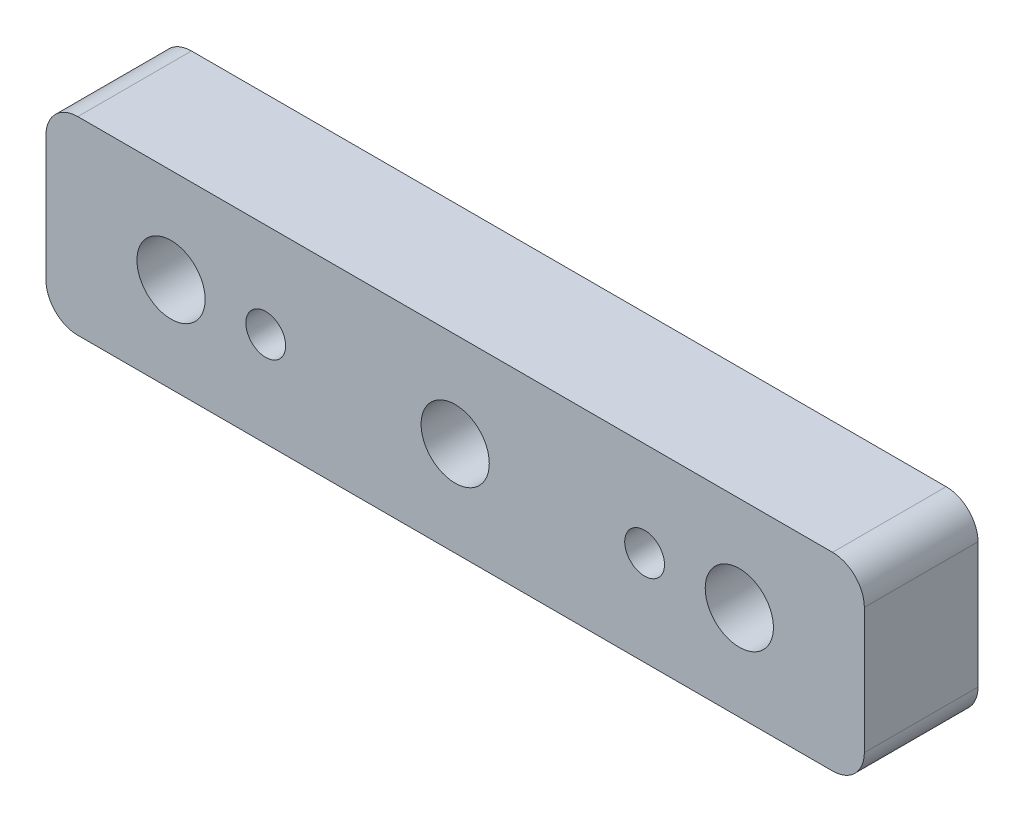
from build123d import *

# Parameters (mm, degrees)
BOSS_EXTRUDE1_DEPTH   = 12
SKETCH3_R             = 3.6
CUT_EXTRUDE2_DEPTH    = 46.937348639
M5X0_8_TAPPED_HOLE1_D = 4.2


with BuildPart() as part:
    # Sketch1 → Boss-Extrude1 (new body)
    with BuildSketch(Plane.XY):
        with BuildLine():
            Line((39.84, -10), (-39.84, -10))
            ThreePointArc((-39.84, -10), (-42.215878785, -9.015878785), (-43.2, -6.64))
            Line((-43.2, -6.64), (-43.2, 6.64))
            ThreePointArc((-43.2, 6.64), (-42.215878785, 9.015878785), (-39.84, 10))
            Line((-39.84, 10), (39.84, 10))
            ThreePointArc((39.84, 10), (42.215878785, 9.015878785), (43.2, 6.64))
            Line((43.2, 6.64), (43.2, -6.64))
            ThreePointArc((43.2, -6.64), (42.215878785, -9.015878785), (39.84, -10))
        make_face()
    extrude(amount=BOSS_EXTRUDE1_DEPTH)

    # Sketch3 → Cut-Extrude2 (cut, through all)
    with BuildSketch(Plane.XY.offset(12)):
        with Locations((-30, 0)):
            Circle(SKETCH3_R)
        with Locations(Location((30, 0, 0), (0, 0, 180))):
            Circle(SKETCH3_R)
        Circle(SKETCH3_R)
    extrude(amount=-CUT_EXTRUDE2_DEPTH, mode=Mode.SUBTRACT)

    # M5x0.8 Tapped Hole1 (through all)
    with Locations(Plane.XY.offset(12)):
        with Locations((-20, 0), (20, 0)):
            Hole(M5X0_8_TAPPED_HOLE1_D / 2)


solid = part.part
